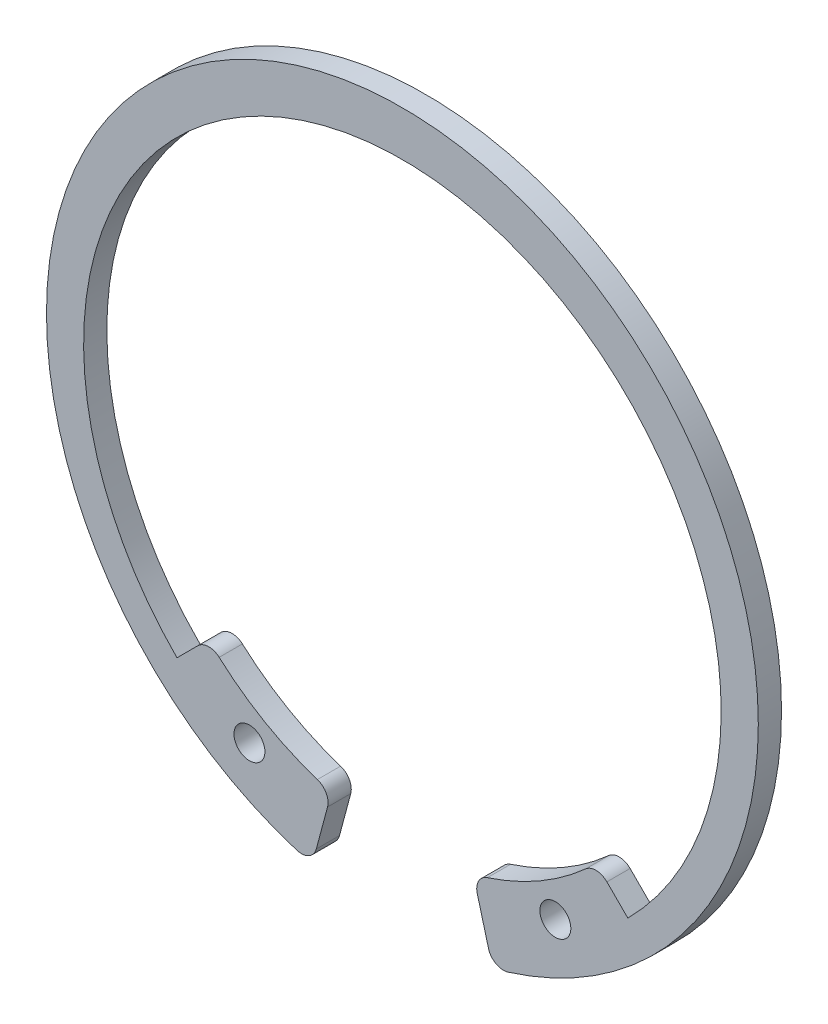
from build123d import *

# Parameters (mm, degrees)
ESQUISSE1_R          = 1
BASE_EXTRUSION_DEPTH = 1.5


with BuildPart() as part:
    # Esquisse1 → Base-Extrusion (new body)
    with BuildSketch(Plane.XY):
        with BuildLine():
            Line((5.564558924, -20.767216626), (4.837312367, -18.053095527))
            ThreePointArc((4.837312367, -18.053095527), (4.924160237, -17.31759845), (5.493181049, -16.84355856))
            ThreePointArc((5.493181049, -16.84355856), (8.858336511, -15.343088908), (11.840359078, -13.179013616))
            ThreePointArc((11.840359078, -13.179013616), (12.535400072, -12.923247082), (13.215783159, -13.215783159))
            Line((13.215783159, -13.215783159), (14.566399692, -14.566399692))
            ThreePointArc((14.566399692, -14.566399692), (0, 20.6), (-14.566399692, -14.566399692))
            Line((-14.566399692, -14.566399692), (-13.215783159, -13.215783159))
            ThreePointArc((-13.215783159, -13.215783159), (-12.535400072, -12.923247082), (-11.840359078, -13.179013616))
            ThreePointArc((-11.840359078, -13.179013616), (-8.858336511, -15.343088908), (-5.493181049, -16.84355856))
            ThreePointArc((-5.493181049, -16.84355856), (-4.924160237, -17.31759845), (-4.837312367, -18.053095527))
            Line((-4.837312367, -18.053095527), (-5.564558924, -20.767216626))
            ThreePointArc((-5.564558924, -20.767216626), (-6.047721334, -21.384148392), (-6.827324966, -21.463324744))
            ThreePointArc((-6.827324966, -21.463324744), (0, 23.5), (6.827324966, -21.463324744))
            ThreePointArc((6.827324966, -21.463324744), (6.047721334, -21.384148392), (5.564558924, -20.767216626))
        make_face()
        with Locations((-9.883667669, -16.988277884)):
            Circle(ESQUISSE1_R, mode=Mode.SUBTRACT)
        with Locations(Location((9.883667669, -16.988277884, 0), (0, 0, 180))):
            Circle(ESQUISSE1_R, mode=Mode.SUBTRACT)
    extrude(amount=BASE_EXTRUSION_DEPTH)


solid = part.part
